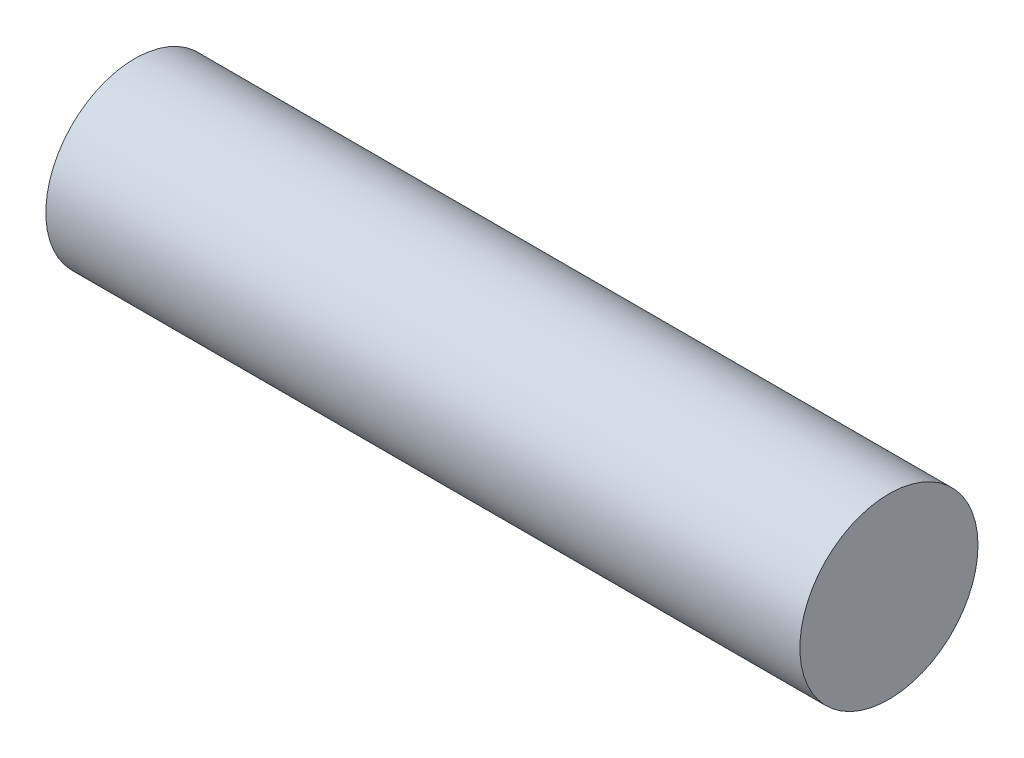
from build123d import *

# Parameters (mm, degrees)
SKETCH2_R           = 3
BOSS_EXTRUDE1_DEPTH = 25.4


with BuildPart() as part:
    # Sketch2 → Boss-Extrude1 (new body)
    with BuildSketch(Plane(origin=(0, 0, 0), x_dir=(0, 0, -1), z_dir=(1, 0, 0))):
        Circle(SKETCH2_R)
    extrude(amount=BOSS_EXTRUDE1_DEPTH)


solid = part.part
